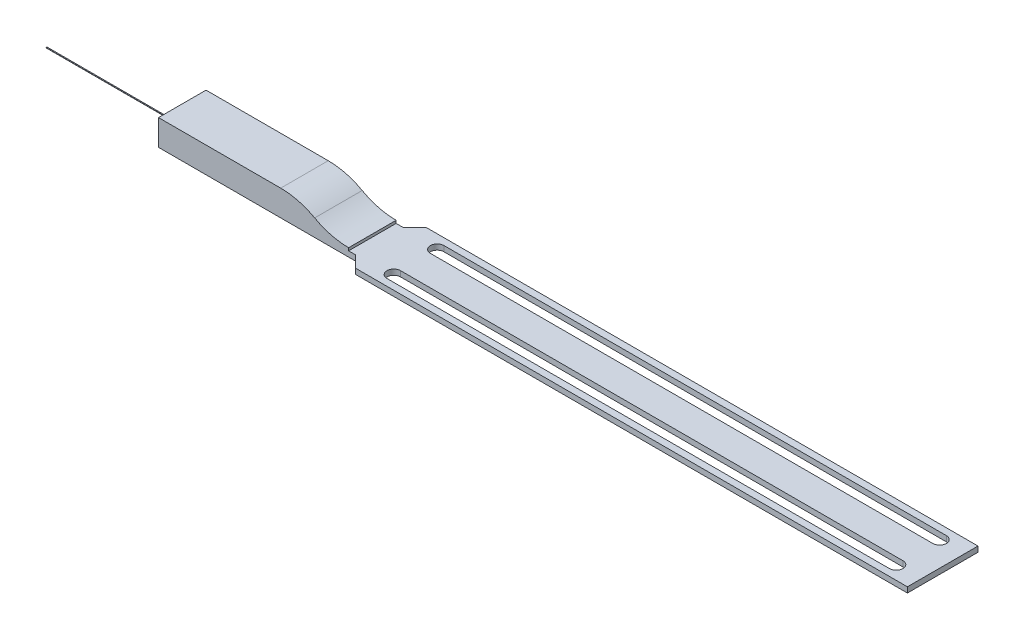
from build123d import *

# Parameters (mm, degrees)
SKETCH1_W               = 14
SKETCH1_H               = 3.5
BOSS_EXTRUDE1_DEPTH     = 1.9
BOSS_EXTRUDE2_DEPTH     = 0.4
CUT_EXTRUDE1_DEPTH      = 50.105702317
CUT_EXTRUDE1_DEPTH_BACK = 50.105702317
SKETCH4_W               = 0.07
SKETCH4_H               = 0.024
BOSS_EXTRUDE3_DEPTH     = 10


with BuildPart() as part:
    # Sketch1 → Boss-Extrude1 (new body)
    with BuildSketch(Plane(origin=(0, 0, 0), x_dir=(1, 0, 0), z_dir=(0, 1, 0))):
        Rectangle(SKETCH1_W, SKETCH1_H)
    extrude(amount=BOSS_EXTRUDE1_DEPTH)

    # Sketch2 → Boss-Extrude2 (add)
    with BuildSketch(Plane.XZ):
        Polygon((7, -1.75), (7.5, -1.75), (8.35, -2.6), (49, -2.6), (49, 2.6), (8.35, 2.6), (7.5, 1.75), (7, 1.75), align=None)
        with BuildLine():
            Line((47.175, 1.1), (10.175, 1.1))
            ThreePointArc((10.175, 1.1), (9.675, 1.6), (10.175, 2.1))
            Line((10.175, 2.1), (47.175, 2.1))
            ThreePointArc((47.175, 2.1), (47.675, 1.6), (47.175, 1.1))
        make_face(mode=Mode.SUBTRACT)
        with BuildLine():
            Line((47.175, -2.1), (10.175, -2.1))
            ThreePointArc((10.175, -2.1), (9.675, -1.6), (10.175, -1.1))
            Line((10.175, -1.1), (47.175, -1.1))
            ThreePointArc((47.175, -1.1), (47.675, -1.6), (47.175, -2.1))
        make_face(mode=Mode.SUBTRACT)
    extrude(amount=-BOSS_EXTRUDE2_DEPTH)

    # Sketch3 → Cut-Extrude1 (cut, two sides: drawn at the far end of the back side and taken through both)
    with BuildSketch(Plane.XY.offset(-CUT_EXTRUDE1_DEPTH_BACK)):
        with BuildLine():
            Line((7, 0.6), (7, 1.9))
            Line((7, 1.9), (2, 1.9))
            ThreePointArc((2, 1.9), (3.291559135, 1.734842828), (4.5, 1.25))
            ThreePointArc((4.5, 1.25), (5.708440865, 0.765157172), (7, 0.6))
        make_face()
    extrude(amount=CUT_EXTRUDE1_DEPTH + CUT_EXTRUDE1_DEPTH_BACK, mode=Mode.SUBTRACT)

    # Sketch4 → Boss-Extrude3 (add)
    with BuildSketch(Plane.ZY.offset(7)):
        with Locations((0, 0.5)):
            Rectangle(SKETCH4_W, SKETCH4_H)
    extrude(amount=BOSS_EXTRUDE3_DEPTH)


solid = part.part
